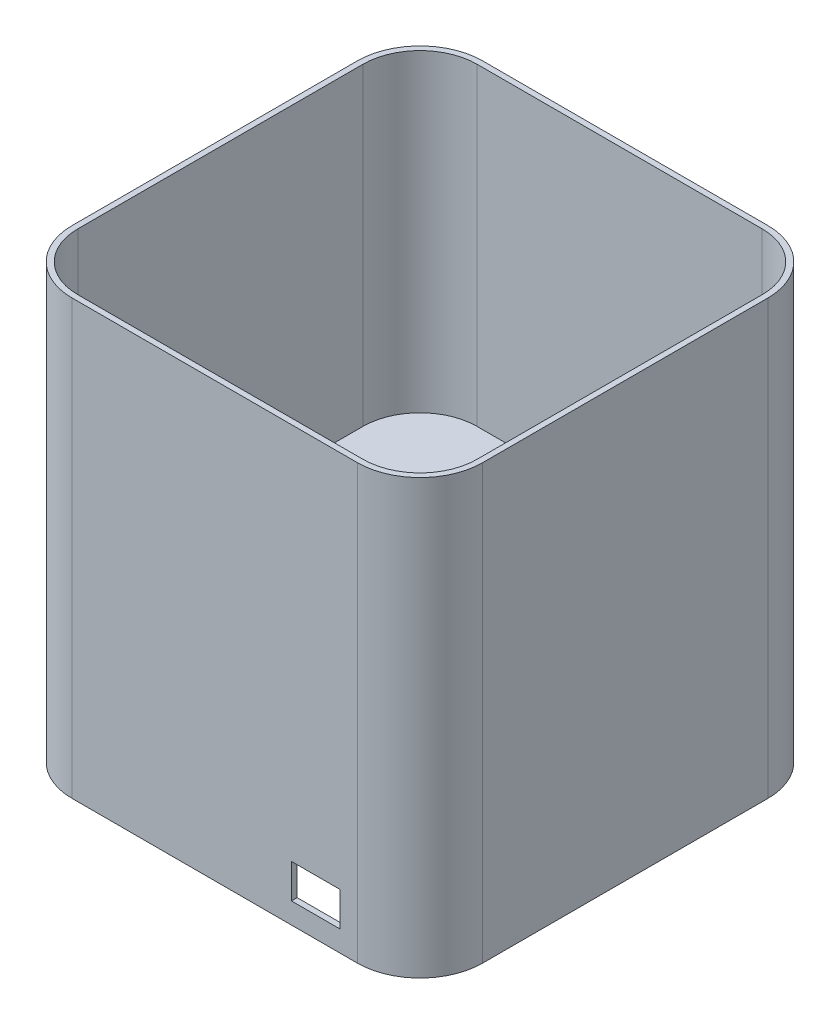
from build123d import *

# Parameters (mm, degrees)
ESQUISSE1_W             = 140
ESQUISSE1_H             = 140
BOSS_EXTRU_1_DEPTH      = 150
CONG_1_R                = 20
COQUE1_T                = 2
BOSS_EXTRU_2_START      = 40
BOSS_EXTRU_2_DEPTH      = 40
ENL_V_START             = -38
ENL_V_MAT_EXTRU_1_DEPTH = 38
ESQUISSE4_W             = 23
ESQUISSE4_H             = 2
ENL_V_MAT_EXTRU_2_DEPTH = 33
ESQUISSE5_W             = 70
ESQUISSE5_H             = 24
ENL_V_MAT_EXTRU_3_DEPTH = 33
ESQUISSE6_W             = 17
ESQUISSE6_H             = 12
ENL_V_MAT_EXTRU_4_DEPTH = 33
BOSS_EXTRU_3_DEPTH      = 23
BOSS_EXTRU_4_DEPTH      = 23
ESQUISSE12_R            = 1.475
BOSS_EXTRU_5_DEPTH      = 3


with BuildPart() as part:
    # Esquisse1 → Boss.-Extru.1 (new body)
    with BuildSketch(Plane(origin=(0, 0, 0), x_dir=(1, 0, 0), z_dir=(0, 1, 0))):
        Rectangle(ESQUISSE1_W, ESQUISSE1_H)
    extrude(amount=BOSS_EXTRU_1_DEPTH)

    # Congé1
    cong_1_edges = [part.edges().sort_by_distance(p)[0] for p in [
        (70, 75, 70),
        (-70, 75, 70),
        (-70, 75, -70),
        (70, 75, -70),
    ]]
    fillet(cong_1_edges, radius=CONG_1_R)

    # Coque1
    coque1_openings = [part.faces().sort_by_distance(p)[0] for p in [
        (0, 150, 0),
    ]]
    offset(amount=COQUE1_T, openings=coque1_openings, kind=Kind.INTERSECTION)

    # Esquisse2 → Boss.-Extru.2 (add)
    with BuildSketch(Plane(origin=(0, 0, 0), x_dir=(1, 0, 0), z_dir=(0, 1, 0)).offset(BOSS_EXTRU_2_START)):
        with BuildLine():
            Line((70, -50), (70, 50))
            ThreePointArc((70, 50), (64.142135624, 64.142135624), (50, 70))
            Line((50, 70), (-50, 70))
            ThreePointArc((-50, 70), (-64.142135624, 64.142135624), (-70, 50))
            Line((-70, 50), (-70, -50))
            ThreePointArc((-70, -50), (-64.142135624, -64.142135624), (-50, -70))
            Line((-50, -70), (50, -70))
            ThreePointArc((50, -70), (64.142135624, -64.142135624), (70, -50))
        make_face()
    extrude(amount=-BOSS_EXTRU_2_DEPTH)

    # Esquisse3 → Enlèv. mat.-Extru.1 (cut)
    with BuildSketch(Plane.XZ.offset(2).offset(ENL_V_START)):
        with BuildLine():
            Line((70, -50), (70, 50))
            ThreePointArc((70, 50), (64.142135624, 64.142135624), (50, 70))
            Line((50, 70), (-50, 70))
            ThreePointArc((-50, 70), (-64.142135624, 64.142135624), (-70, 50))
            Line((-70, 50), (-70, -50))
            ThreePointArc((-70, -50), (-64.142135624, -64.142135624), (-50, -70))
            Line((-50, -70), (50, -70))
            ThreePointArc((50, -70), (64.142135624, -64.142135624), (70, -50))
        make_face()
    extrude(amount=ENL_V_MAT_EXTRU_1_DEPTH, mode=Mode.SUBTRACT)

    # Esquisse4 → Enlèv. mat.-Extru.2 (cut)
    with BuildSketch(Plane.XZ.offset(-36)):
        with Locations((0, 34.941356373)):
            Rectangle(ESQUISSE4_W, ESQUISSE4_H)
    extrude(amount=-ENL_V_MAT_EXTRU_2_DEPTH, mode=Mode.SUBTRACT)

    # Esquisse5 → Enlèv. mat.-Extru.3 (cut)
    with BuildSketch(Plane(origin=(0, 0, -72), x_dir=(-1, 0, 0), z_dir=(0, 0, -1))):
        with Locations((0, 16.5)):
            Rectangle(ESQUISSE5_W, ESQUISSE5_H)
    extrude(amount=-ENL_V_MAT_EXTRU_3_DEPTH, mode=Mode.SUBTRACT)

    # Esquisse6 → Enlèv. mat.-Extru.4 (cut)
    with BuildSketch(Plane.XY.offset(72)):
        with Locations((35.41933702, 11.338578381)):
            Rectangle(ESQUISSE6_W, ESQUISSE6_H)
    extrude(amount=-ENL_V_MAT_EXTRU_4_DEPTH, mode=Mode.SUBTRACT)

    # Esquisse7 → Boss.-Extru.3 (add)
    with BuildSketch(Plane.ZY.offset(-11.5)):
        Polygon((33.941356373, 40), (34.841356373, 40), (34.841356373, 39.856828703), (33.941356373, 39.75), align=None)
    extrude(amount=BOSS_EXTRU_3_DEPTH)

    # Esquisse10 → Boss.-Extru.4 (add)
    with BuildSketch(Plane(origin=(-11.5, 0, 0), x_dir=(0, 0, -1), z_dir=(1, 0, 0))):
        Polygon((-35.941356373, 40), (-35.041356373, 40), (-35.041356373, 39.885374009), (-35.941356373, 39.75), align=None)
    extrude(amount=BOSS_EXTRU_4_DEPTH)

    # Esquisse12 → Boss.-Extru.5 (add)
    with BuildSketch(Plane(origin=(0, 0, 70), x_dir=(-1, 0, 0), z_dir=(0, 0, -1))):
        with Locations(Location((28.043934099, 18.476473505, 0), (0, 0, 180))):
            Circle(ESQUISSE12_R)
    extrude(amount=BOSS_EXTRU_5_DEPTH)


solid = part.part
